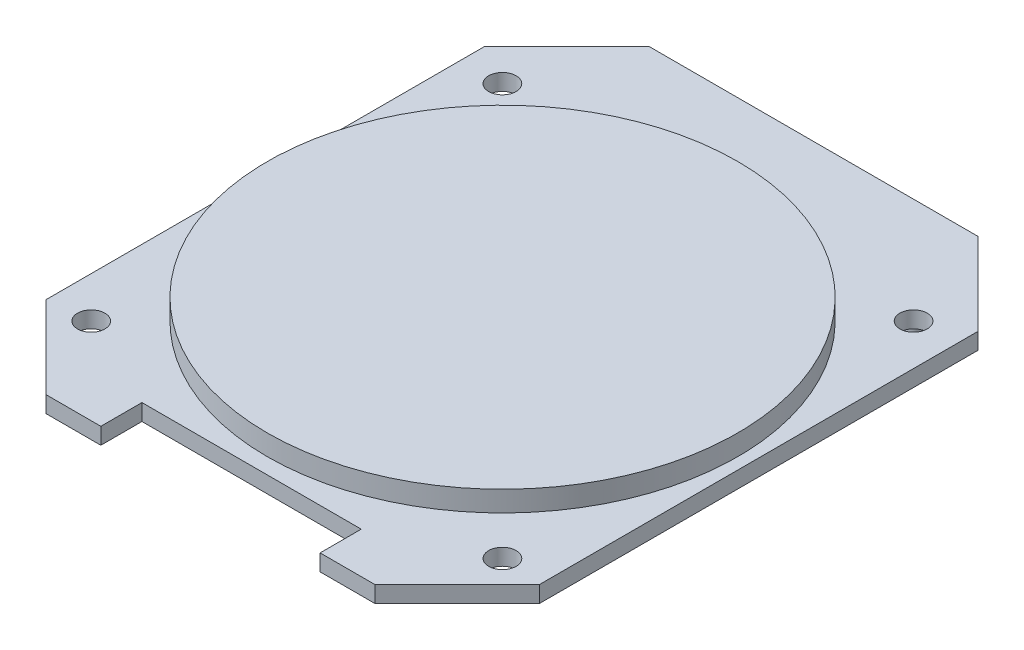
from build123d import *

# Parameters (mm, degrees)
SKETCH_1_R      = 1
EXTRUDE_1_DEPTH = 1.2
SKETCH_2_R      = 17.16
EXTRUDE_2_DEPTH = 1.5
SKETCH_3_W      = 12
SKETCH_3_H      = 4.5
SKETCH_3_W_2    = 22.86
SKETCH_3_H_2    = 2.54
EXTRUDE_3_DEPTH = 2
SKETCH_4_R      = 0.5
EXTRUDE_4_DEPTH = 8


with BuildPart() as part:
    # 草图1 → 凸台-拉伸1 (new body)
    with BuildSketch(Plane(origin=(0, 0, 0), x_dir=(1, 0, 0), z_dir=(0, 1, 0))):
        Polygon((-12, 44), (12, 44), (18, 38), (18, 6), (12, 0), (8, 0), (8, 3), (-8, 3), (-8, 0), (-12, 0), (-18, 6), (-18, 38), align=None)
        with Locations(Location((15, 6.3, 0), (0, 0, 270))):
            Circle(SKETCH_1_R, mode=Mode.SUBTRACT)
        with Locations(Location((15, 36.3, 0), (0, 0, 90))):
            Circle(SKETCH_1_R, mode=Mode.SUBTRACT)
        with Locations(Location((-15, 6.3, 0), (0, 0, 90))):
            Circle(SKETCH_1_R, mode=Mode.SUBTRACT)
        with Locations(Location((-15, 36.3, 0), (0, 0, 270))):
            Circle(SKETCH_1_R, mode=Mode.SUBTRACT)
    extrude(amount=EXTRUDE_1_DEPTH)

    # 草图2 → 凸台-拉伸2 (add)
    with BuildSketch(Plane(origin=(0, 1.2, 0), x_dir=(1, 0, 0), z_dir=(0, 1, 0))):
        with Locations(Location((0, 21.31, 0), (0, 0, 270))):
            Circle(SKETCH_2_R)
    extrude(amount=EXTRUDE_2_DEPTH)

    # 草图3 → 凸台-拉伸3 (add)
    with BuildSketch(Plane.XZ):
        with Locations((0, -30.25)):
            Rectangle(SKETCH_3_W, SKETCH_3_H)
        with Locations((0, -42.73)):
            Rectangle(SKETCH_3_W_2, SKETCH_3_H_2)
    extrude(amount=EXTRUDE_3_DEPTH)

    # 草图4 → 凸台-拉伸4 (add)
    with BuildSketch(Plane.XZ):
        with Locations(Location((-1.27, -42.5, 0), (0, 0, 90))):
            Circle(SKETCH_4_R)
        with Locations(Location((-3.81, -42.5, 0), (0, 0, 90))):
            Circle(SKETCH_4_R)
        with Locations(Location((-6.35, -42.5, 0), (0, 0, 90))):
            Circle(SKETCH_4_R)
        with Locations(Location((-8.89, -42.5, 0), (0, 0, 90))):
            Circle(SKETCH_4_R)
        with Locations(Location((8.89, -42.5, 0), (0, 0, 90))):
            Circle(SKETCH_4_R)
        with Locations(Location((6.35, -42.5, 0), (0, 0, 90))):
            Circle(SKETCH_4_R)
        with Locations(Location((3.81, -42.5, 0), (0, 0, 90))):
            Circle(SKETCH_4_R)
        with Locations(Location((1.27, -42.5, 0), (0, 0, 90))):
            Circle(SKETCH_4_R)
    extrude(amount=EXTRUDE_4_DEPTH)


solid = part.part
